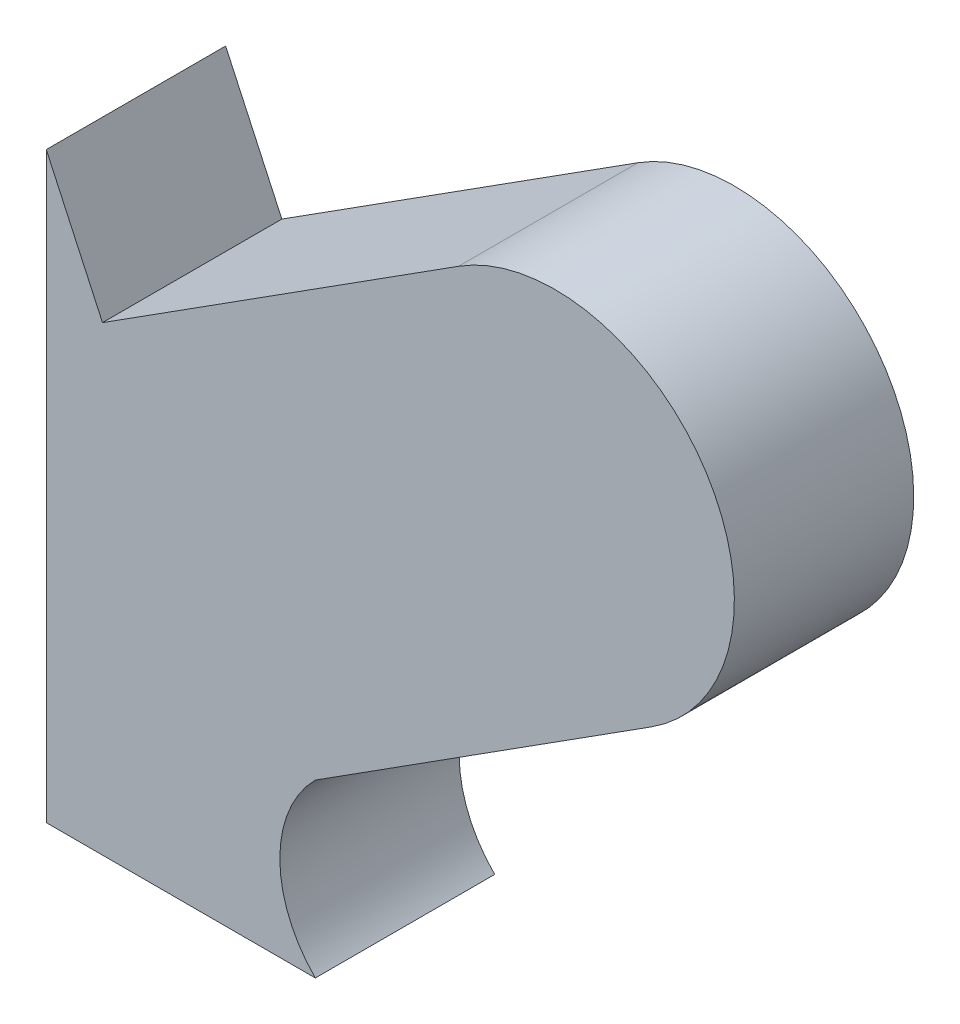
from build123d import *

# Parameters (mm, degrees)
BOSS_EXTRUDE1_DEPTH = 10


with BuildPart() as part:
    # Sketch1 → Boss-Extrude1 (new body)
    with BuildSketch(Plane.XY):
        with BuildLine():
            Line((0, 0), (0, 32.5))
            Line((0, 32.5), (3.133753016, 25.7102018))
            Line((3.133753016, 25.7102018), (22.989665666, 38.35981325))
            ThreePointArc((22.989665666, 38.35981325), (36.796576207, 35.298894875), (33.735657833, 21.491984334))
            Line((33.735657833, 21.491984334), (15, 9.556053912))
            ThreePointArc((15, 9.556053912), (13.020876433, 4.778026956), (15, 0))
            Line((15, 0), (0, 0))
        make_face()
    extrude(amount=BOSS_EXTRUDE1_DEPTH)


solid = part.part
